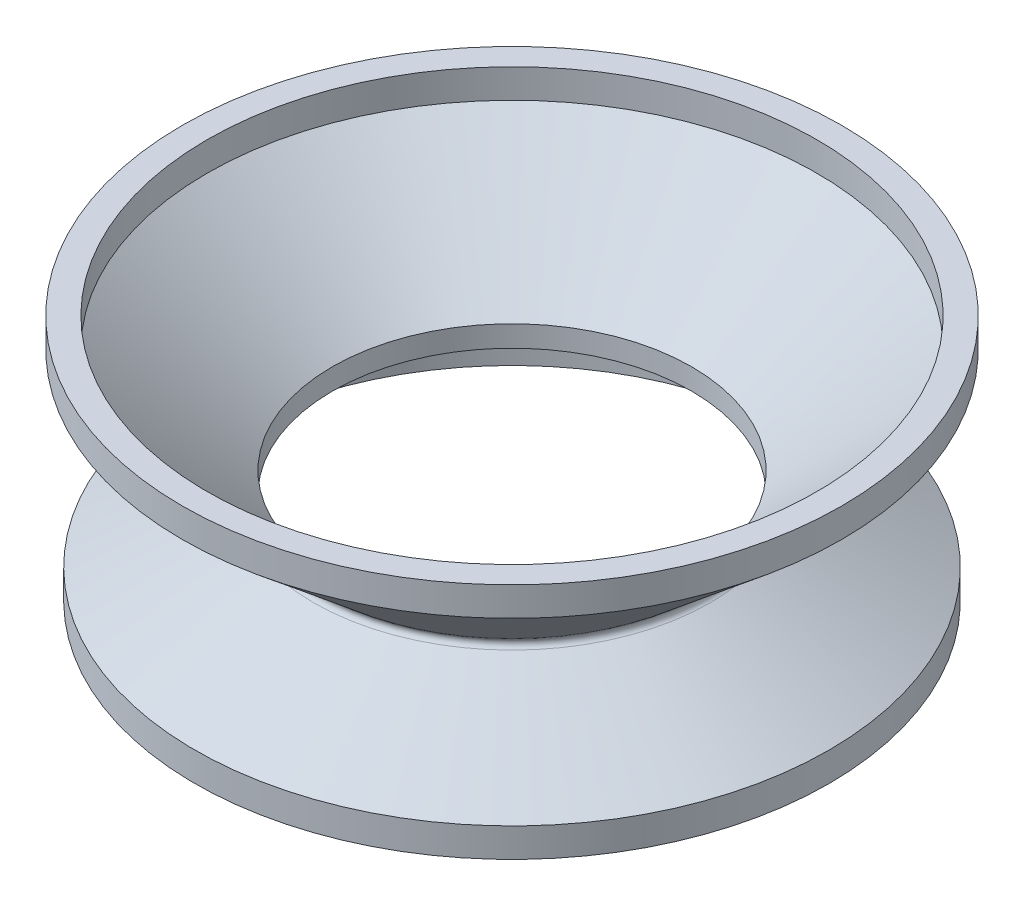
from build123d import *

# Parameters (mm, degrees)
FILLET2_R           = 0.4
SKETCH2_R           = 22.71129621
SKETCH2_R_2         = 21
BOSS_EXTRUDE1_DEPTH = 2
SKETCH3_R           = 21.837521507
SKETCH3_R_2         = 19.837521507
BOSS_EXTRUDE2_DEPTH = 2


with BuildPart() as part:
    # Sketch1 → Revolve1 (revolve)
    with BuildSketch(Plane.XY):
        Polygon((0.662781953, 0), (-8.871246788, 8), (-7.159950579, 8), (1.462781953, 0.764668313), (1.462781953, -0.692820323), (-5.997472085, -5), (-7.997472085, -5), align=None)
    revolve(axis=Axis((13.840049421, 7.609018033, 0), (0, -1, 0)))

    # Fillet2
    fillet2_edges = [part.edges().sort_by_distance(p)[0] for p in [
        (27.01731689, 0, 0),
    ]]
    fillet(fillet2_edges, radius=FILLET2_R)

    # Sketch2 → Boss-Extrude1 (add)
    with BuildSketch(Plane(origin=(0, 8, 0), x_dir=(1, 0, 0), z_dir=(0, 1, 0))):
        with Locations(Location((13.840049421, 0, 0), (0, 0, 180))):
            Circle(SKETCH2_R)
        with Locations(Location((13.840049421, 0, 0), (0, 0, 180))):
            Circle(SKETCH2_R_2, mode=Mode.SUBTRACT)
    extrude(amount=BOSS_EXTRUDE1_DEPTH)

    # Sketch3 → Boss-Extrude2 (add)
    with BuildSketch(Plane.XZ.offset(5)):
        with Locations((13.840049421, 0)):
            Circle(SKETCH3_R)
        with Locations(Location((13.840049421, 0, 0), (0, 0, 180))):
            Circle(SKETCH3_R_2, mode=Mode.SUBTRACT)
    extrude(amount=BOSS_EXTRUDE2_DEPTH)


solid = part.part
